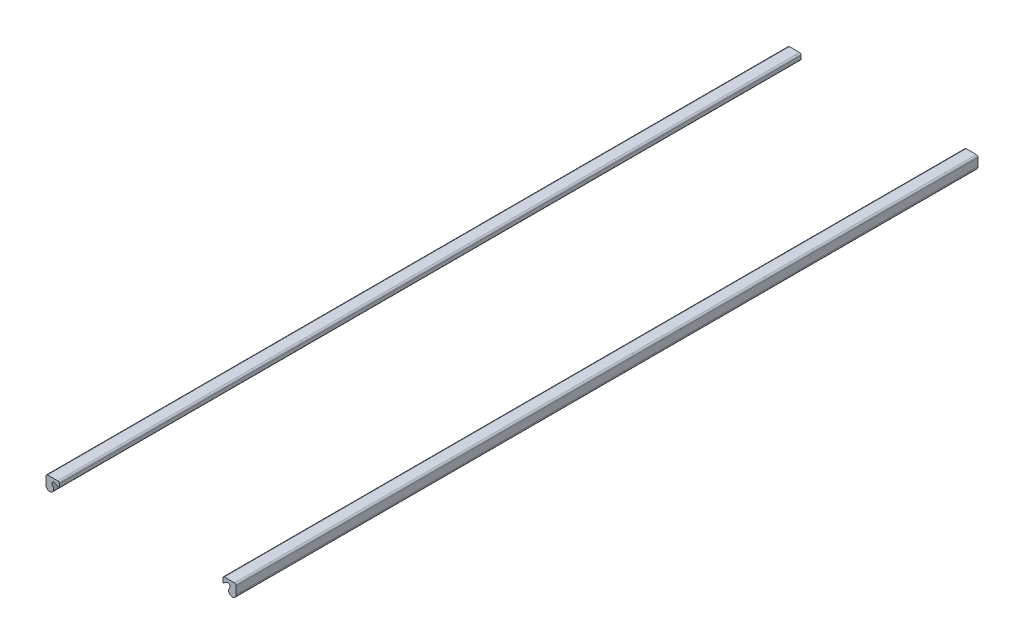
from build123d import *

# Parameters (mm, degrees)
TINY_RED_DEPTH   = 27.7
TINY_RED_2_DEPTH = 27.7


with BuildPart() as part:
    # Tiny Red Profile → Tiny Red (new, symmetric)
    with BuildSketch(Plane.XY):
        with BuildLine():
            Line((-7.1, 4.582842712), (-7.1, 5.18))
            ThreePointArc((-7.1, 5.18), (-7.064852814, 5.264852814), (-6.98, 5.3))
            Line((-6.98, 5.3), (-6.22, 5.3))
            ThreePointArc((-6.22, 5.3), (-6.135147186, 5.264852814), (-6.1, 5.18))
            Line((-6.1, 5.18), (-6.1, 4.920710678))
            ThreePointArc((-6.1, 4.920710678), (-6.13236303, 4.873924598), (-6.187557492, 4.887704091))
            add(Edge.make_bspline(
                [(-6.187557492, 4.887704091), (-6.389214842, 5.117165695), (-6.561872943, 5.049237628), (-6.734531044, 4.981309562), (-6.578122573, 4.734045904)],
                knots=[1.458408765, 1.458408765, 1.458408765, 2.897791101, 2.897791101, 4.337173437, 4.337173437, 4.337173437], degree=2, weights=[1, 0.752009332, 1, 0.752009332, 1]))
            ThreePointArc((-6.578122573, 4.734045904), (-6.73844651, 4.311172667), (-7.1, 4.582842712))
        make_face()
    extrude(amount=TINY_RED_DEPTH, both=True)


with BuildPart() as body_2:
    # Tiny Red Profile → Tiny Red 2 (new, symmetric)
    with BuildSketch(Plane.XY):
        with BuildLine():
            Line((7.1, 4.582842712), (7.1, 5.18))
            ThreePointArc((7.1, 5.18), (7.064852814, 5.264852814), (6.98, 5.3))
            Line((6.98, 5.3), (6.22, 5.3))
            ThreePointArc((6.22, 5.3), (6.135147186, 5.264852814), (6.1, 5.18))
            Line((6.1, 5.18), (6.1, 4.920710678))
            ThreePointArc((6.1, 4.920710678), (6.13236303, 4.873924598), (6.187557492, 4.887704091))
            add(Edge.make_bspline(
                [(6.578122573, 4.734045904), (6.734531044, 4.981309562), (6.561872943, 5.049237628), (6.389214842, 5.117165695), (6.187557492, 4.887704091)],
                knots=[1.946011871, 1.946011871, 1.946011871, 3.385394206, 3.385394206, 4.824776542, 4.824776542, 4.824776542], degree=2, weights=[1, 0.752009332, 1, 0.752009332, 1]))
            ThreePointArc((6.578122573, 4.734045904), (6.73844651, 4.311172667), (7.1, 4.582842712))
        make_face()
    extrude(amount=TINY_RED_2_DEPTH, both=True)


solid = Compound([part.part, body_2.part])
